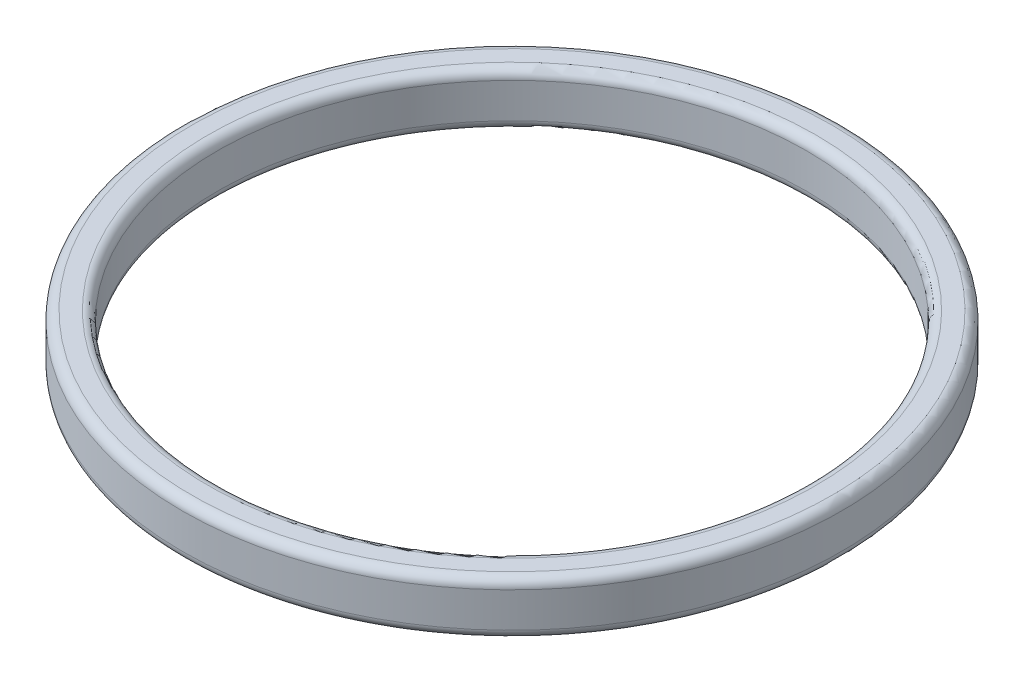
from build123d import *


with BuildPart() as part:
    # Эскиз1 → Повернуть1 (revolve)
    with BuildSketch(Plane.XY, mode=Mode.PRIVATE) as revolve_1_sk:
        with BuildLine():
            Line((-16.5, 0), (-17.4, 0))
            ThreePointArc((-17.4, 0), (-17.753553391, 0.146446609), (-17.9, 0.5))
            Line((-17.9, 0.5), (-17.9, 2.4))
            ThreePointArc((-17.9, 2.4), (-17.753553391, 2.753553391), (-17.4, 2.9))
            Line((-17.4, 2.9), (-16.5, 2.9))
            ThreePointArc((-16.5, 2.9), (-16.146446609, 2.753553391), (-16, 2.4))
            Line((-16, 2.4), (-16, 0.5))
            ThreePointArc((-16, 0.5), (-16.146446609, 0.146446609), (-16.5, 0))
        make_face()
    revolve(revolve_1_sk.sketch.rotate(Axis((0, 0, 0), (0, 1, 0)), 270), axis=Axis((0, 0, 0), (0, 1, 0)))


solid = part.part
